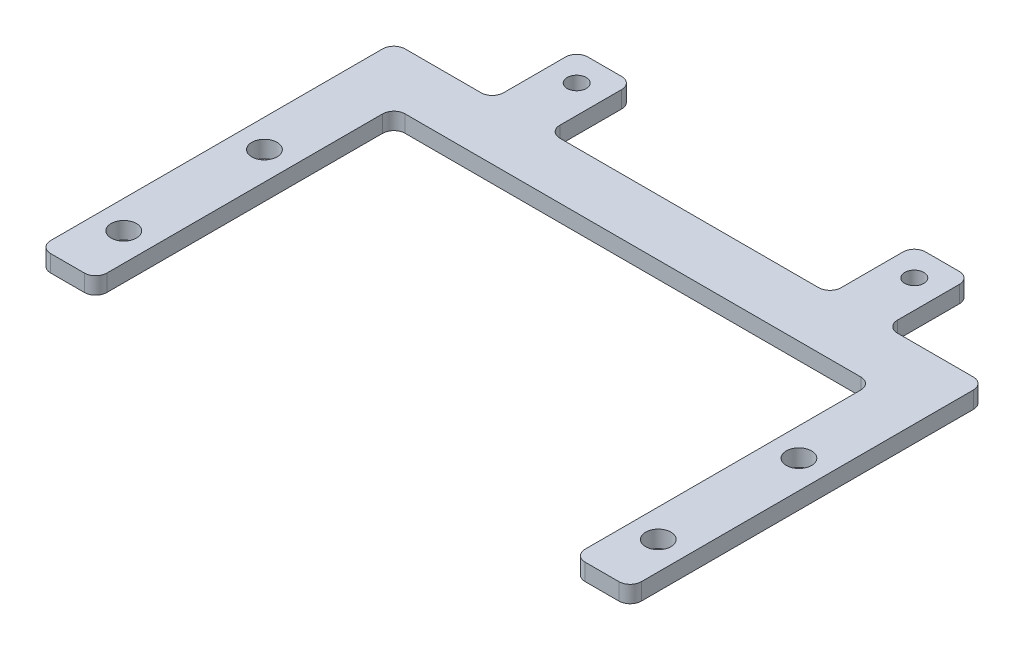
from build123d import *

# Parameters (mm, degrees)
EXTRUDE_1_DEPTH     = 3
SKETCH_2_R          = 2.25
SKETCH_2_R_2        = 1.7
CUT_EXTRUDE_1_DEPTH = 3
FILLET_1_R          = 2


with BuildPart() as part:
    # 草图1 → 凸台-拉伸1 (new body)
    with BuildSketch(Plane(origin=(0, 0, 0), x_dir=(1, 0, 0), z_dir=(0, 1, 0))):
        Polygon((42.5, -31.5), (52.5, -31.5), (52.5, 31.5), (35, 31.5), (35, 46.5), (25, 46.5), (25, 31.5), (-25, 31.5), (-25, 46.5), (-35, 46.5), (-35, 31.5), (-52.5, 31.5), (-52.5, -31.5), (-42.5, -31.5), (-42.5, 21.5), (42.5, 21.5), align=None)
    extrude(amount=EXTRUDE_1_DEPTH)

    # 草图2 → 切除-拉伸1 (cut)
    with BuildSketch(Plane(origin=(0, 3, 0), x_dir=(1, 0, 0), z_dir=(0, 1, 0))):
        with Locations(Location((-47.5, -21.5, 0), (0, 0, 270))):
            Circle(SKETCH_2_R)
        with Locations(Location((-47.5, 3.5, 0), (0, 0, 270))):
            Circle(SKETCH_2_R)
        with Locations(Location((-30, 41.5, 0), (0, 0, 270))):
            Circle(SKETCH_2_R_2)
        with Locations(Location((47.5, -21.5, 0), (0, 0, 90))):
            Circle(SKETCH_2_R)
        with Locations(Location((47.5, 3.5, 0), (0, 0, 90))):
            Circle(SKETCH_2_R)
        with Locations(Location((30, 41.5, 0), (0, 0, 90))):
            Circle(SKETCH_2_R_2)
    extrude(amount=-CUT_EXTRUDE_1_DEPTH, mode=Mode.SUBTRACT)

    # 圆角1
    fillet_1_edges = [part.edges().sort_by_distance(p)[0] for p in [
        (52.5, 1.5, -31.5),
        (52.5, 1.5, 31.5),
        (42.5, 1.5, 31.5),
        (42.5, 1.5, -21.5),
        (-42.5, 1.5, -21.5),
        (-42.5, 1.5, 31.5),
        (-52.5, 1.5, 31.5),
        (-52.5, 1.5, -31.5),
        (-35, 1.5, -31.5),
        (-35, 1.5, -46.5),
        (-25, 1.5, -46.5),
        (-25, 1.5, -31.5),
        (25, 1.5, -31.5),
        (25, 1.5, -46.5),
        (35, 1.5, -46.5),
        (35, 1.5, -31.5),
    ]]
    fillet(fillet_1_edges, radius=FILLET_1_R)


solid = part.part
